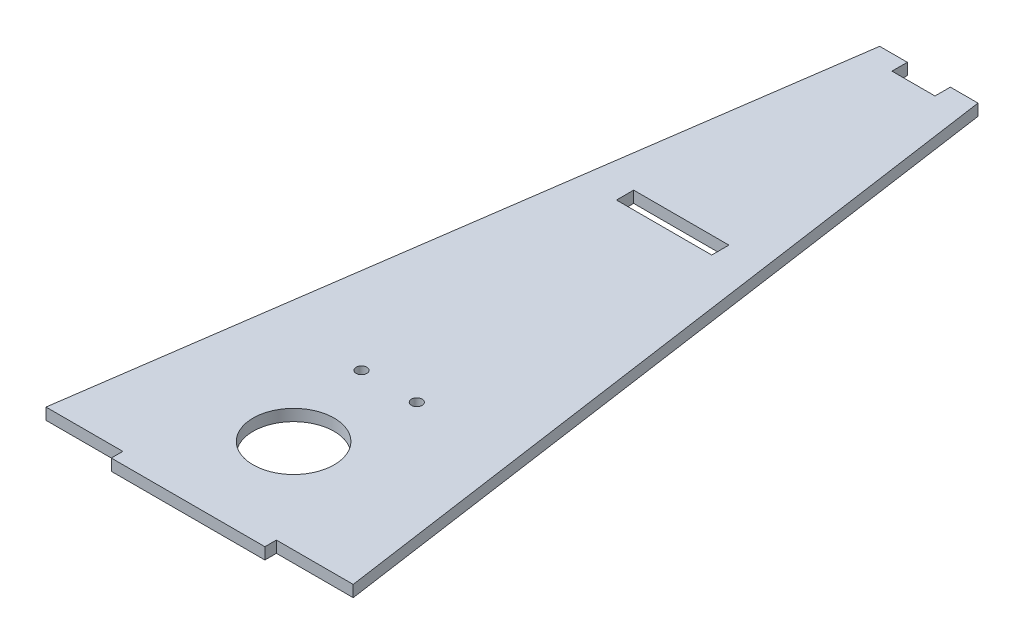
from build123d import *

# Parameters (mm, degrees)
BOSS_EXTRUDE1_DEPTH = 4.7625
SKETCH2_R           = 16.764
SKETCH2_R_2         = 2.2225
SKETCH2_W           = 17.78
SKETCH2_H           = 6.35
SKETCH2_W_2         = 39.37
SKETCH2_H_2         = 7.112
CUT_EXTRUDE1_DEPTH  = 309.122058256
SKETCH3_W           = 63.5
SKETCH3_H           = 4.7625
BOSS_EXTRUDE2_DEPTH = 4.7625


with BuildPart() as part:
    # Sketch1 → Boss-Extrude1 (new body)
    with BuildSketch(Plane(origin=(0, 0, 0), x_dir=(1, 0, 0), z_dir=(0, 1, 0))):
        Polygon((63.5, 0), (-63.5, 0), (-20.325994648, 301.470183232), (20.325994648, 301.470183232), align=None)
    extrude(amount=BOSS_EXTRUDE1_DEPTH)

    # Sketch2 → Cut-Extrude1 (cut, through all)
    with BuildSketch(Plane(origin=(0, 4.7625, 0), x_dir=(1, 0, 0), z_dir=(0, 1, 0))):
        with Locations(Location((0, 38.862, 0), (0, 0, 270))):
            Circle(SKETCH2_R)
        with Locations(Location((-11.43, 78.359, 0), (0, 0, 270))):
            Circle(SKETCH2_R_2)
        with Locations(Location((11.43, 78.359, 0), (0, 0, 270))):
            Circle(SKETCH2_R_2)
        with Locations((0, 298.295183232)):
            Rectangle(SKETCH2_W, SKETCH2_H)
        with Locations((0, 195.58)):
            Rectangle(SKETCH2_W_2, SKETCH2_H_2)
    extrude(amount=-CUT_EXTRUDE1_DEPTH, mode=Mode.SUBTRACT)

    # Sketch3 → Boss-Extrude2 (add)
    with BuildSketch(Plane.XY):
        with Locations((0, 2.38125)):
            Rectangle(SKETCH3_W, SKETCH3_H)
    extrude(amount=BOSS_EXTRUDE2_DEPTH)


solid = part.part
